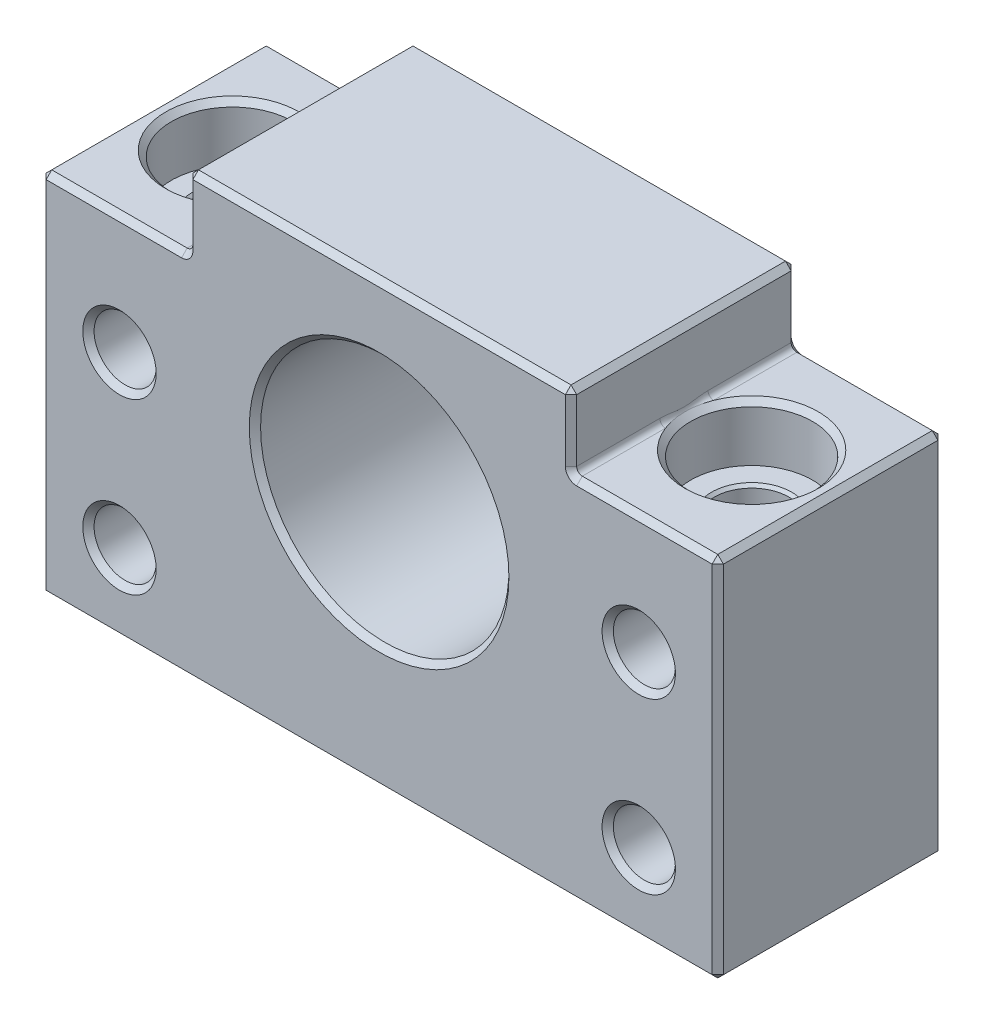
from build123d import *

# Parameters (mm, degrees)
BF_BODY_DEPTH                = 10
BALL_BEARING_HOLE_DEPTH      = 39.522720569
BALL_BEARING_HOLE_DEPTH_BACK = 39.522720569
BALL_BEARING_HOLE_SKETCH_R   = 11
VERTICAL_HOLES_AT_2_COUNT    = 2
VERTICAL_HOLES_AT_2_PITCH    = 46
HORIZONTAL_HOLES_AT_2_COUNT  = 2
HORIZONTAL_HOLES_AT_2_PITCH  = 46
HORIZONTAL_HOLES_AT_3_COUNT  = 2
HORIZONTAL_HOLES_AT_3_PITCH  = 48.383881614
HORIZONTAL_HOLES_AT_4_COUNT  = 2
HORIZONTAL_HOLES_AT_4_PITCH  = 15
PRODUCTION_FILET_R           = 0.5
ESTETIC_CHAMFER_SIZE         = 0.5


with BuildPart() as part:
    # BF Body Sketch → BF Body (new, symmetric)
    with BuildSketch(Plane.XY):
        Polygon((30, -22), (-30, -22), (-30, 10.5), (-17, 10.5), (-17, 17), (17, 17), (17, 10.5), (30, 10.5), align=None)
    extrude(amount=BF_BODY_DEPTH, both=True)

    # Ball Bearing Hole Sketch → Ball Bearing Hole (cut, two sides: drawn at the far end of the back side and taken through both)
    with BuildSketch(Plane.XY.offset(-BALL_BEARING_HOLE_DEPTH_BACK)):
        Circle(BALL_BEARING_HOLE_SKETCH_R)
    extrude(amount=BALL_BEARING_HOLE_DEPTH + BALL_BEARING_HOLE_DEPTH_BACK, mode=Mode.SUBTRACT)

    # Sketch2 → Vertical Holes (revolve, cut)
    with BuildSketch(Plane(origin=(-23, 10.5, 0), x_dir=(0, 0, 1), z_dir=(1, 0, 0))):
        Polygon((0, 0), (0, 32.5), (3.8, 32.5), (3.3, 32), (3.3, 5.25), (3.55, 5), (5.4, 5), (5.4, 0.5), (5.9, 0), align=None)
    vertical_holes = revolve(axis=Axis((-23, 16.85, 0), (0, -1, 0)), mode=Mode.SUBTRACT)

    # Vertical Holes at 2: Vertical Holes ×2
    with Locations(*[(i * VERTICAL_HOLES_AT_2_PITCH, 0, 0) for i in range(1, VERTICAL_HOLES_AT_2_COUNT)]):
        add(vertical_holes, mode=Mode.SUBTRACT)

    # Sketch4 → Horizontal Holes (revolve, cut)
    with BuildSketch(Plane(origin=(-23, 0, 10), x_dir=(0, -1, 0), z_dir=(1, 0, 0))):
        Polygon((0, 0), (0, 20), (3.25, 20), (2.75, 19.5), (2.75, 0.5), (3.25, 0), align=None)
    horizontal_holes = revolve(axis=Axis((-23, 0, 16.35), (0, 0, -1)), mode=Mode.SUBTRACT)

    # Horizontal Holes at 2: Horizontal Holes ×2
    with Locations(*[(i * HORIZONTAL_HOLES_AT_2_PITCH, 0, 0) for i in range(1, HORIZONTAL_HOLES_AT_2_COUNT)]):
        add(horizontal_holes, mode=Mode.SUBTRACT)

    # Horizontal Holes at 3: Horizontal Holes ×2
    with Locations(*[Vector(0.9507298394814789, -0.31002059983091673, 0) * (i * HORIZONTAL_HOLES_AT_3_PITCH) for i in range(1, HORIZONTAL_HOLES_AT_3_COUNT)]):
        add(horizontal_holes, mode=Mode.SUBTRACT)

    # Horizontal Holes at 4: Horizontal Holes ×2
    with Locations(*[(0, -i * HORIZONTAL_HOLES_AT_4_PITCH, 0) for i in range(1, HORIZONTAL_HOLES_AT_4_COUNT)]):
        add(horizontal_holes, mode=Mode.SUBTRACT)

    # Production Filet
    production_filet_edges = [part.edges().sort_by_distance(p)[0] for p in [
        (-17, 10.5, 0),
        (17, 10.5, 0),
    ]]
    fillet(production_filet_edges, radius=PRODUCTION_FILET_R)

    # Estetic Chamfer
    estetic_chamfer_edges = [part.edges().sort_by_distance(p)[0] for p in [
        (23.75, 10.5, -10),
        (17, 14, -10),
        (17, 14, 10),
        (30, -5.75, -10),
        (-17.146446609, 10.646446609, -10),
        (-17.146446609, 10.646446609, 10),
        (17.146446609, 10.646446609, -10),
        (17.146446609, 10.646446609, 10),
        (0, 17, 10),
        (30, -22, 0),
        (-30, -22, 0),
        (-30, 10.5, 0),
        (-17, 17, 0),
        (17, 17, 0),
        (30, 10.5, 0),
        (-17, 14, 10),
        (-30, -5.75, 10),
        (-11, 0, -10),
        (-11, 0, 10),
        (0, -22, 10),
        (30, -5.75, 10),
        (23.75, 10.5, 10),
        (0, -22, -10),
        (-30, -5.75, -10),
        (-17, 14, -10),
        (0, 17, -10),
        (-23.75, 10.5, -10),
        (-23.75, 10.5, 10),
    ]]
    chamfer(estetic_chamfer_edges, length=ESTETIC_CHAMFER_SIZE)


solid = part.part
